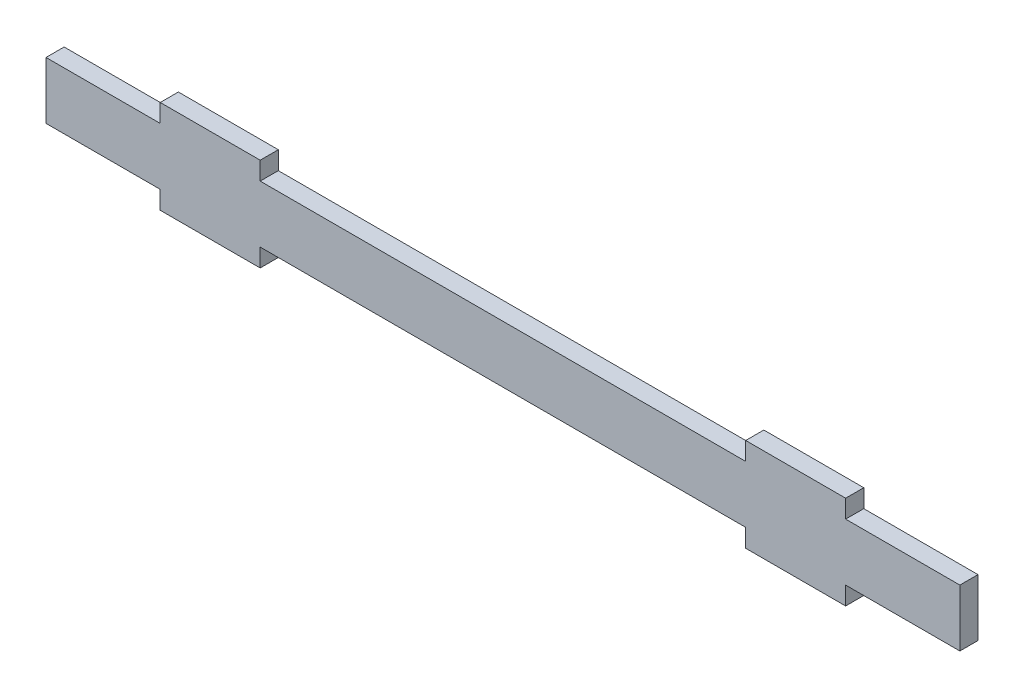
from build123d import *

# Parameters (mm, degrees)
BOSS_EXTRUDE1_DEPTH = 6.35


with BuildPart() as part:
    # Sketch1 → Boss-Extrude1 (new body)
    with BuildSketch(Plane.XY):
        Polygon((-160, -5), (-120, -5), (-120, -11.35), (-85, -11.35), (-85, -5), (85, -5), (85, -11.35), (120, -11.35), (120, -5), (160, -5), (160, 15), (120, 15), (120, 21.35), (85, 21.35), (85, 15), (-85, 15), (-85, 21.35), (-120, 21.35), (-120, 15), (-160, 15), align=None)
    extrude(amount=BOSS_EXTRUDE1_DEPTH)


solid = part.part
